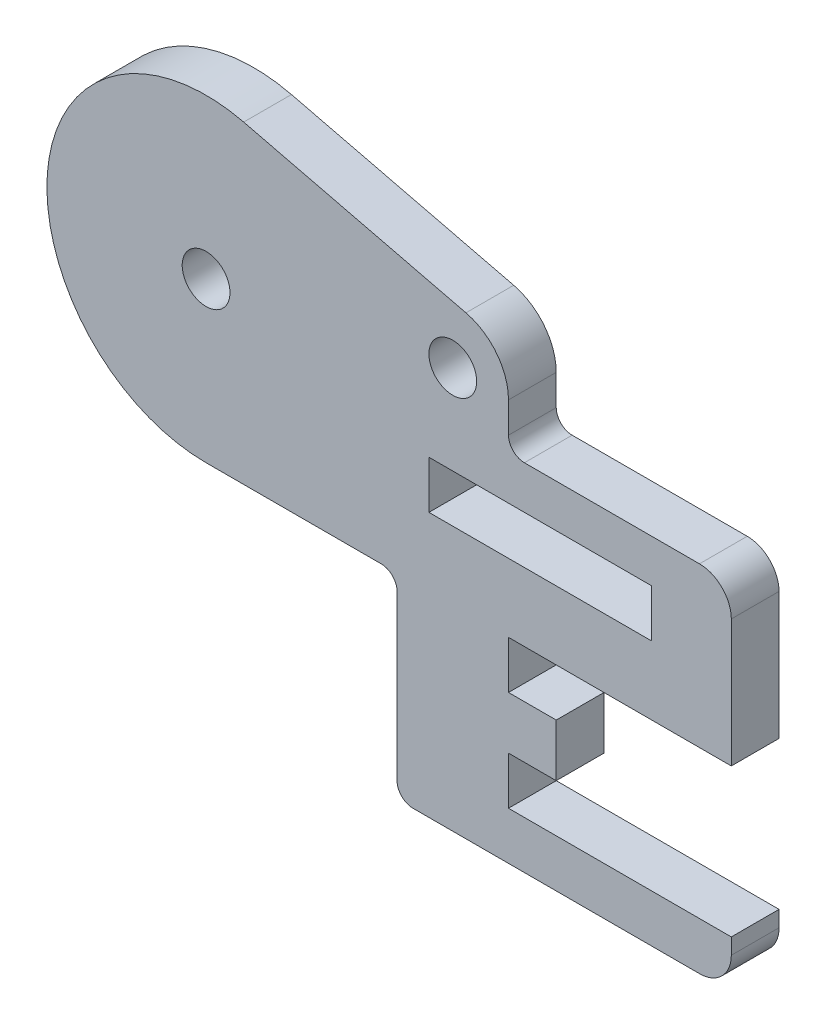
from build123d import *

# Parameters (mm, degrees)
BOSS_EXTRUDE1_DEPTH = 3
SKETCH2_R           = 1.5
CUT_EXTRUDE1_DEPTH  = 3
SKETCH3_W           = 14
SKETCH3_H           = 3
CUT_EXTRUDE2_DEPTH  = 3
SKETCH6_R           = 1.5
CUT_EXTRUDE5_DEPTH  = 3
SKETCH7_W           = 11
SKETCH7_H           = 3.3
CUT_EXTRUDE6_DEPTH  = 3


with BuildPart() as part:
    # Sketch1 → Boss-Extrude1 (new body)
    with BuildSketch(Plane.XY):
        with BuildLine():
            Line((3.822175283, -5.149900319), (3.822175283, -23.449900319))
            ThreePointArc((3.822175283, -23.449900319), (3.236388845, -24.864113882), (1.822175283, -25.449900319))
            Line((1.822175283, -25.449900319), (-16.177824717, -25.449900319))
            ThreePointArc((-16.177824717, -25.449900319), (-16.884931499, -25.157007101), (-17.177824717, -24.449900319))
            Line((-17.177824717, -24.449900319), (-17.177824717, -14.149900319))
            ThreePointArc((-17.177824717, -14.149900319), (-17.470717936, -13.442793538), (-18.177824717, -13.149900319))
            Line((-18.177824717, -13.149900319), (-29.177824717, -13.149900319))
            ThreePointArc((-29.177824717, -13.149900319), (-39.106770847, -1.959930257), (-26.814794989, 6.566893931))
            Line((-26.814794989, 6.566893931), (-12.850764313, 3.170977668))
            ThreePointArc((-12.850764313, 3.170977668), (-10.926033354, 1.932885914), (-10.177824717, -0.229900319))
            Line((-10.177824717, -0.229900319), (-10.177824717, -2.149900319))
            ThreePointArc((-10.177824717, -2.149900319), (-9.884931499, -2.857007101), (-9.177824717, -3.149900319))
            Line((-9.177824717, -3.149900319), (1.822175283, -3.149900319))
            ThreePointArc((1.822175283, -3.149900319), (3.236388845, -3.735686757), (3.822175283, -5.149900319))
        make_face()
    extrude(amount=BOSS_EXTRUDE1_DEPTH)

    # Sketch2 → Cut-Extrude1 (cut)
    with BuildSketch(Plane.XY.offset(3)):
        with Locations((-29.177824717, -3.149900319)):
            Circle(SKETCH2_R)
    extrude(amount=-CUT_EXTRUDE1_DEPTH, mode=Mode.SUBTRACT)

    # Sketch3 → Cut-Extrude2 (cut)
    with BuildSketch(Plane.XY.offset(3)):
        with Locations((-8.177824717, -7.349900319)):
            Rectangle(SKETCH3_W, SKETCH3_H)
        with Locations((-3.177824717, -14.649900319)):
            Rectangle(SKETCH3_W, SKETCH3_H)
        with Locations((-3.177824717, -20.949900319)):
            Rectangle(SKETCH3_W, SKETCH3_H)
    extrude(amount=-CUT_EXTRUDE2_DEPTH, mode=Mode.SUBTRACT)

    # Sketch6 → Cut-Extrude5 (cut)
    with BuildSketch(Plane.XY.offset(3)):
        with Locations((-13.677824717, -0.229900319)):
            Circle(SKETCH6_R)
    extrude(amount=-CUT_EXTRUDE5_DEPTH, mode=Mode.SUBTRACT)

    # Sketch7 → Cut-Extrude6 (cut)
    with BuildSketch(Plane.XY.offset(3)):
        with Locations((-1.677824717, -17.799900319)):
            Rectangle(SKETCH7_W, SKETCH7_H)
    extrude(amount=-CUT_EXTRUDE6_DEPTH, mode=Mode.SUBTRACT)


solid = part.part
